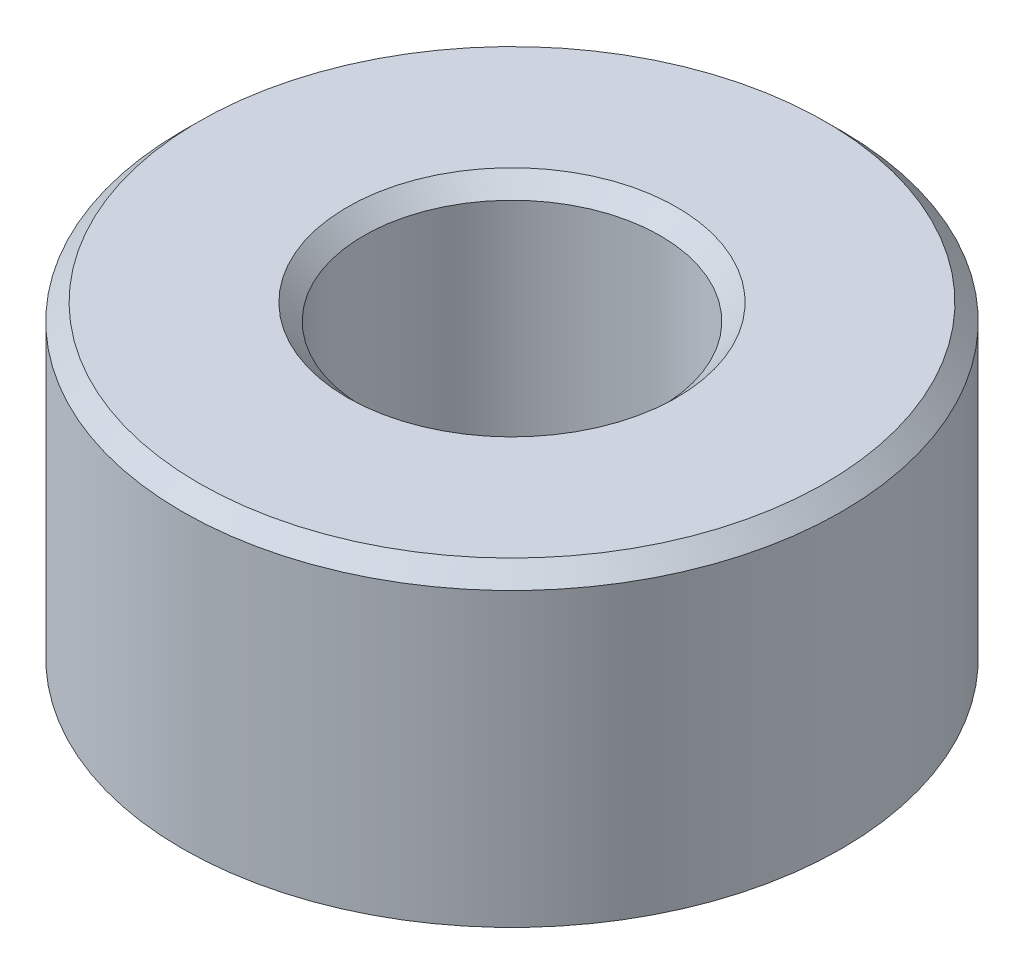
from build123d import *

# Parameters (mm, degrees)
SKETCH1_R     = 10
SKETCH1_R_2   = 4.5
BODY_DEPTH    = 9.35
CHAMFER1_SIZE = 0.5


with BuildPart() as part:
    # Sketch1 → Body (new body)
    with BuildSketch(Plane(origin=(0, 0, 0), x_dir=(1, 0, 0), z_dir=(0, 1, 0))):
        with Locations(Location((0, 0, 0), (0, 0, 270))):
            Circle(SKETCH1_R)
        with Locations(Location((0, 0, 0), (0, 0, 270))):
            Circle(SKETCH1_R_2, mode=Mode.SUBTRACT)
    extrude(amount=BODY_DEPTH)

    # Chamfer1
    chamfer1_edges = [part.edges().sort_by_distance(p)[0] for p in [
        (0, 9.35, -10),
        (0, 9.35, -4.5),
    ]]
    chamfer(chamfer1_edges, length=CHAMFER1_SIZE)


solid = part.part
